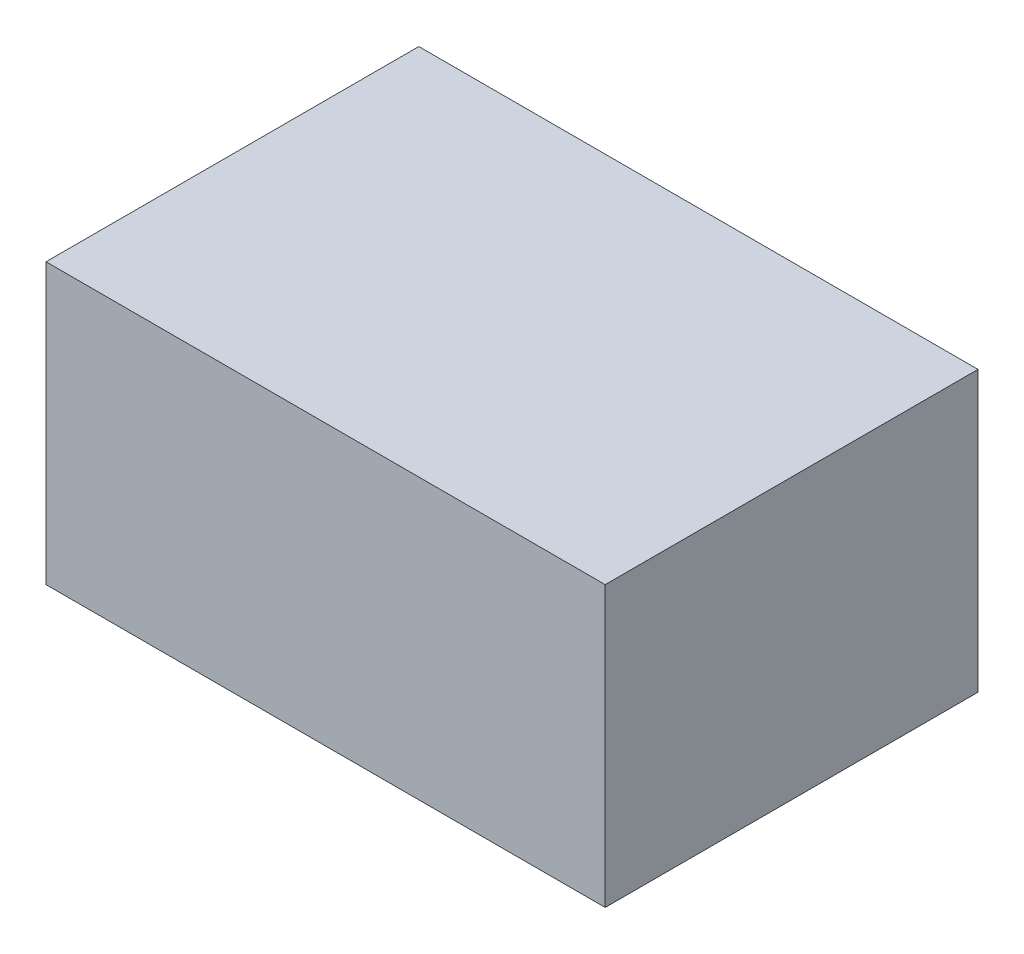
from build123d import *

# Parameters (mm, degrees)
SKETCH1_W           = 300
SKETCH1_H           = 200
BOSS_EXTRUDE1_DEPTH = 150


with BuildPart() as part:
    # Sketch1 → Boss-Extrude1 (new body)
    with BuildSketch(Plane(origin=(0, 0, 0), x_dir=(1, 0, 0), z_dir=(0, 1, 0))):
        with Locations((31.014167124, -37.109375)):
            Rectangle(SKETCH1_W, SKETCH1_H)
    extrude(amount=BOSS_EXTRUDE1_DEPTH)


solid = part.part
